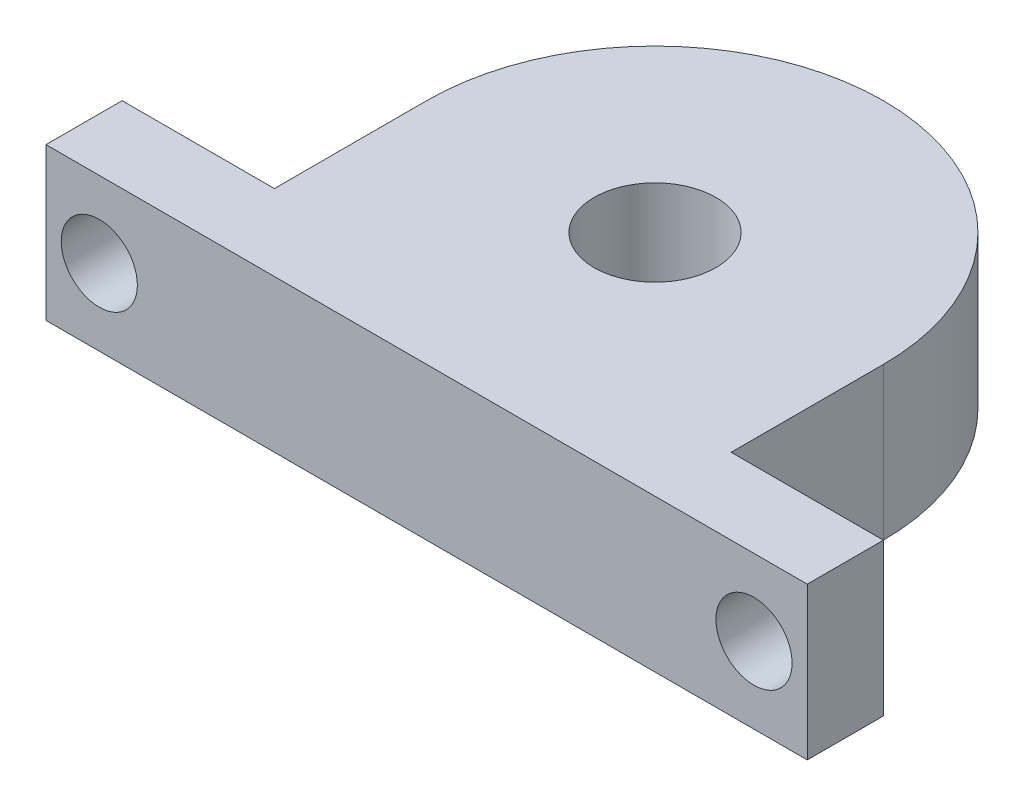
from build123d import *

# Parameters (mm, degrees)
RESSALTO_EXTRUS_O1_DEPTH      = 5
RESSALTO_EXTRUS_O1_DEPTH_BACK = 5
CORTE_EXTRUS_O1_DEPTH         = 5
CORTE_EXTRUS_O1_DEPTH_BACK    = 5
ESBO_O2_R                     = 4
ESBO_O3_R                     = 2.5
CORTE_EXTRUS_O2_DEPTH         = 30.580398915


with BuildPart() as part:
    # Esboço1 → Ressalto-extrusão1 (new, two sides: drawn at the far end of the back side and taken through both)
    with BuildSketch(Plane(origin=(0, 0, 0), x_dir=(1, 0, 0), z_dir=(0, 1, 0)).offset(-RESSALTO_EXTRUS_O1_DEPTH_BACK)):
        with BuildLine():
            Line((-15, 0), (-15, -10))
            Line((-15, -10), (-25, -10))
            Line((-25, -10), (-25, -15))
            Line((-25, -15), (25, -15))
            Line((25, -15), (25, -10))
            Line((25, -10), (15, -10))
            Line((15, -10), (15, 0))
            ThreePointArc((15, 0), (0, 15), (-15, 0))
        make_face()
    extrude(amount=RESSALTO_EXTRUS_O1_DEPTH + RESSALTO_EXTRUS_O1_DEPTH_BACK)

    # Esboço2 → Corte-extrusão1 (cut, two sides: drawn at the far end of the back side and taken through both)
    with BuildSketch(Plane(origin=(0, 0, 0), x_dir=(1, 0, 0), z_dir=(0, 1, 0)).offset(-CORTE_EXTRUS_O1_DEPTH_BACK)):
        Circle(ESBO_O2_R)
    extrude(amount=CORTE_EXTRUS_O1_DEPTH + CORTE_EXTRUS_O1_DEPTH_BACK, mode=Mode.SUBTRACT)

    # Esboço3 → Corte-extrusão2 (cut, through all)
    with BuildSketch(Plane.XY):
        with Locations((21.5, 0)):
            Circle(ESBO_O3_R)
        with Locations((-21.5, 0)):
            Circle(ESBO_O3_R)
    extrude(amount=CORTE_EXTRUS_O2_DEPTH, mode=Mode.SUBTRACT)


solid = part.part
